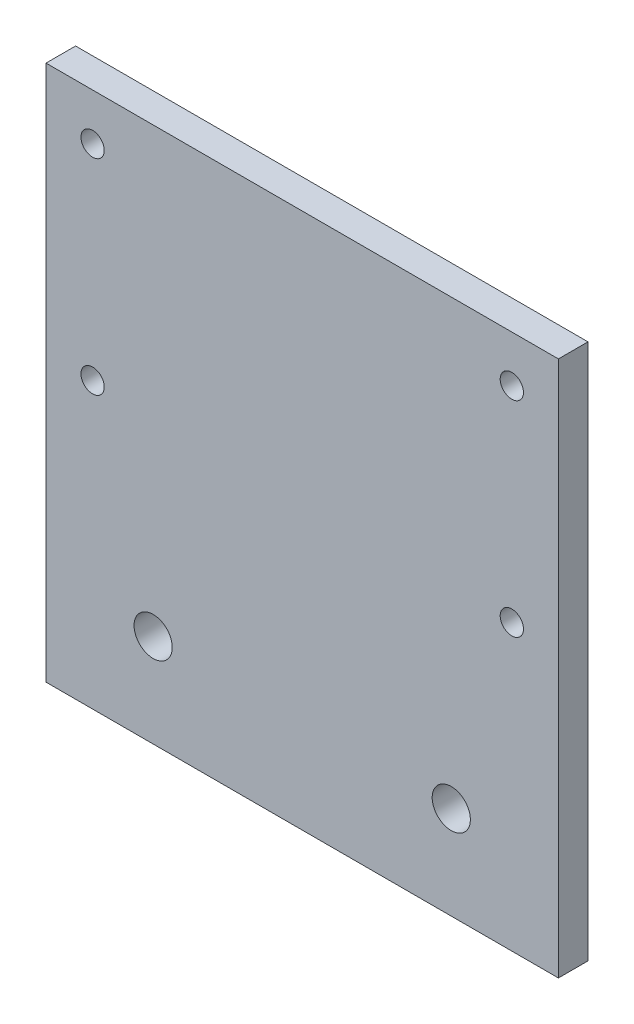
from build123d import *

# Parameters (mm, degrees)
SKETCH1_W           = 55
SKETCH1_H           = 57.55
SKETCH1_R           = 1.25
SKETCH1_R_2         = 2.05
BOSS_EXTRUDE1_DEPTH = 3.175


with BuildPart() as part:
    # Sketch1 → Boss-Extrude1 (new body)
    with BuildSketch(Plane.XY):
        with Locations((27.5, 28.775)):
            Rectangle(SKETCH1_W, SKETCH1_H)
        with Locations((5, 52.55)):
            Circle(SKETCH1_R, mode=Mode.SUBTRACT)
        with Locations((50, 52.55)):
            Circle(SKETCH1_R, mode=Mode.SUBTRACT)
        with Locations((50, 30.55)):
            Circle(SKETCH1_R, mode=Mode.SUBTRACT)
        with Locations((5, 30.55)):
            Circle(SKETCH1_R, mode=Mode.SUBTRACT)
        with Locations((11.5, 10)):
            Circle(SKETCH1_R_2, mode=Mode.SUBTRACT)
        with Locations((43.5, 10)):
            Circle(SKETCH1_R_2, mode=Mode.SUBTRACT)
    extrude(amount=BOSS_EXTRUDE1_DEPTH)


solid = part.part
